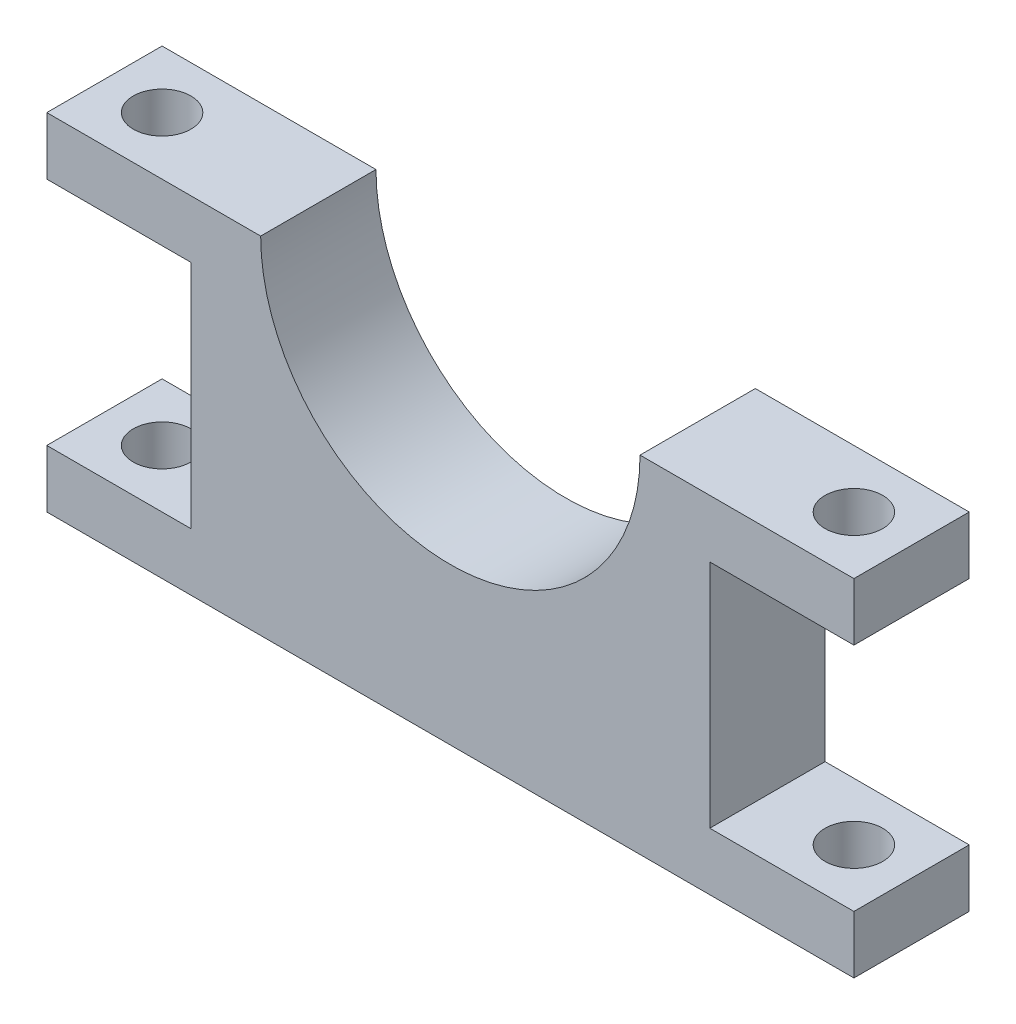
from build123d import *

# Parameters (mm, degrees)
EXTRUDE_1_DEPTH = 5
SKETCH_3_W      = 70
SKETCH_3_H      = 10
SKETCH_3_R      = 2.5
EXTRUDE_2_DEPTH = 5
EXTRUDE_START   = -5
SKETCH_4_W      = 12.5
SKETCH_4_H      = 10
SKETCH_4_R      = 2.5
EXTRUDE_3_DEPTH = 5


with BuildPart() as part:
    # 草图1 → 凸台-拉伸1 (new, symmetric)
    with BuildSketch(Plane.XY):
        with BuildLine():
            Line((16.45, 0), (22.5, 0))
            Line((22.5, 0), (22.5, -30))
            Line((22.5, -30), (-22.5, -30))
            Line((-22.5, -30), (-22.5, 0))
            Line((-22.5, 0), (-16.45, 0))
            ThreePointArc((-16.45, 0), (0, -16.45), (16.45, 0))
        make_face()
    extrude(amount=EXTRUDE_1_DEPTH, both=True)

    # 草图3 → 凸台-拉伸2 (add)
    with BuildSketch(Plane.XZ.offset(30)):
        Rectangle(SKETCH_3_W, SKETCH_3_H)
        with Locations((-30, 0)):
            Circle(SKETCH_3_R, mode=Mode.SUBTRACT)
        with Locations(Location((30, 0, 0), (0, 0, 180))):
            Circle(SKETCH_3_R, mode=Mode.SUBTRACT)
    extrude(amount=-EXTRUDE_2_DEPTH)

    # 草图4 → 凸台-拉伸3 (add)
    # profile 1 of 2: a face of its own
    with BuildSketch(Plane(origin=(0, 0, 0), x_dir=(1, 0, 0), z_dir=(0, 1, 0)).offset(EXTRUDE_START)):
        with Locations((-28.75, 0)):
            Rectangle(SKETCH_4_W, SKETCH_4_H)
        with Locations((-30, 0)):
            Circle(SKETCH_4_R, mode=Mode.SUBTRACT)
    # profile 2 of 2: a face of its own
    with BuildSketch(Plane(origin=(0, 0, 0), x_dir=(1, 0, 0), z_dir=(0, 1, 0)).offset(EXTRUDE_START)):
        with Locations((28.75, 0)):
            Rectangle(SKETCH_4_W, SKETCH_4_H)
        with Locations(Location((30, 0, 0), (0, 0, 180))):
            Circle(SKETCH_4_R, mode=Mode.SUBTRACT)
    extrude(amount=EXTRUDE_3_DEPTH)


solid = part.part
